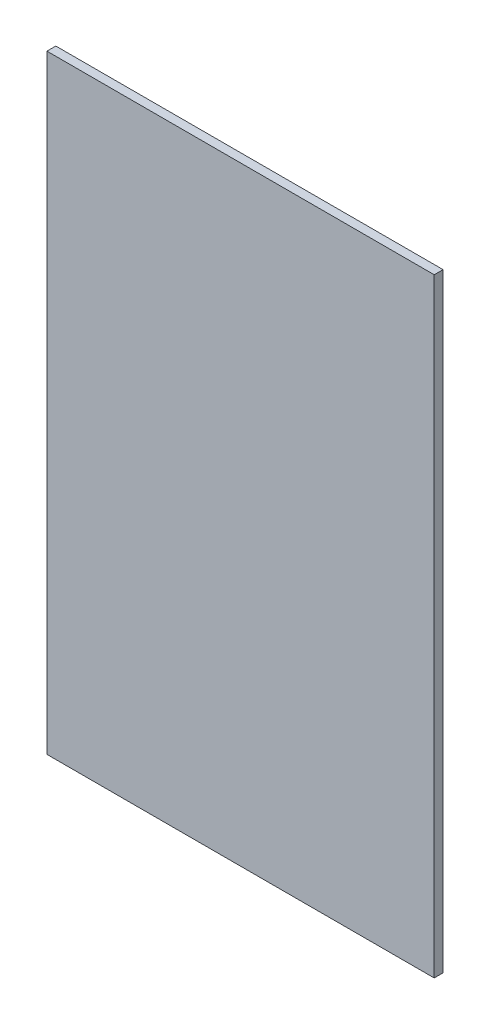
from build123d import *

# Parameters (mm, degrees)
SKETCH1_W           = 131
SKETCH1_H           = 206
BOSS_EXTRUDE1_DEPTH = 3


with BuildPart() as part:
    # Sketch1 → Boss-Extrude1 (new body)
    with BuildSketch(Plane.XY):
        Rectangle(SKETCH1_W, SKETCH1_H)
    extrude(amount=BOSS_EXTRUDE1_DEPTH)


solid = part.part
